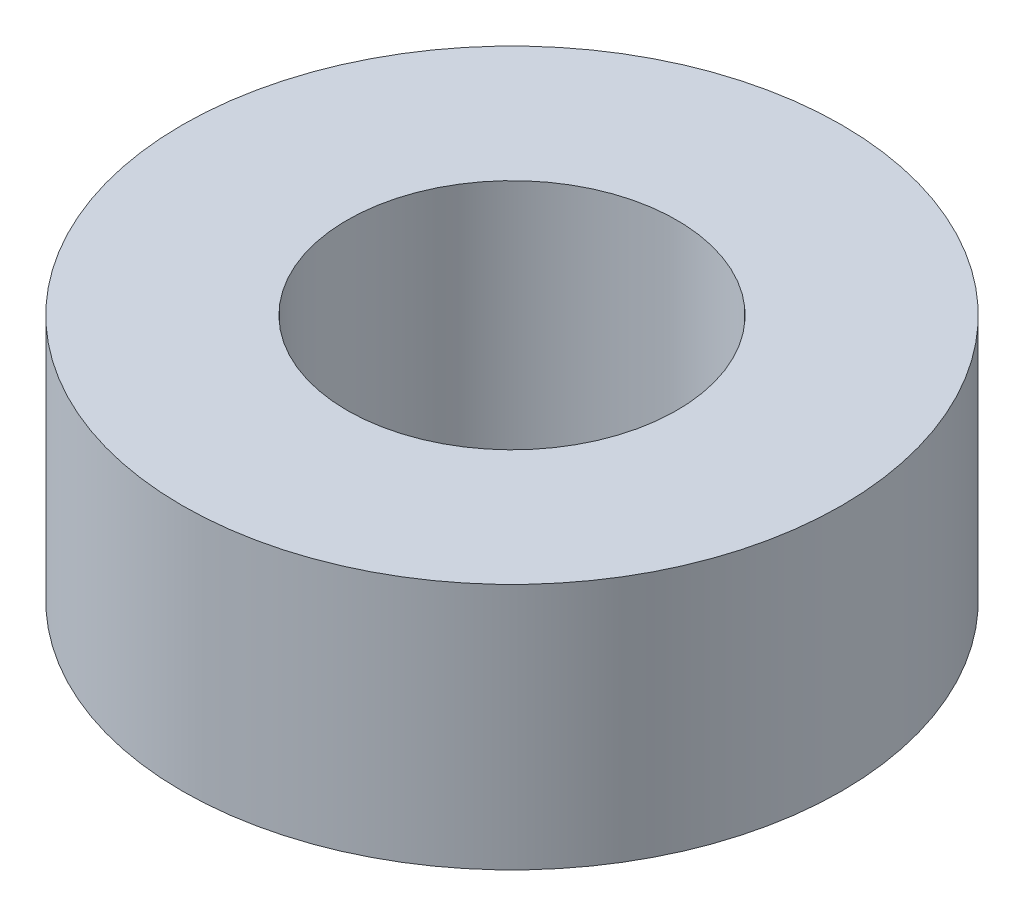
from build123d import *

# Parameters (mm, degrees)
SKETCH1_R           = 4
SKETCH1_R_2         = 2
BOSS_EXTRUDE1_DEPTH = 3


with BuildPart() as part:
    # Sketch1 → Boss-Extrude1 (new body)
    with BuildSketch(Plane(origin=(0, 0, 0), x_dir=(1, 0, 0), z_dir=(0, 1, 0))):
        with Locations(Location((0, 0, 0), (0, 0, 270))):
            Circle(SKETCH1_R)
        with Locations(Location((0, 0, 0), (0, 0, 270))):
            Circle(SKETCH1_R_2, mode=Mode.SUBTRACT)
    extrude(amount=BOSS_EXTRUDE1_DEPTH)


solid = part.part
